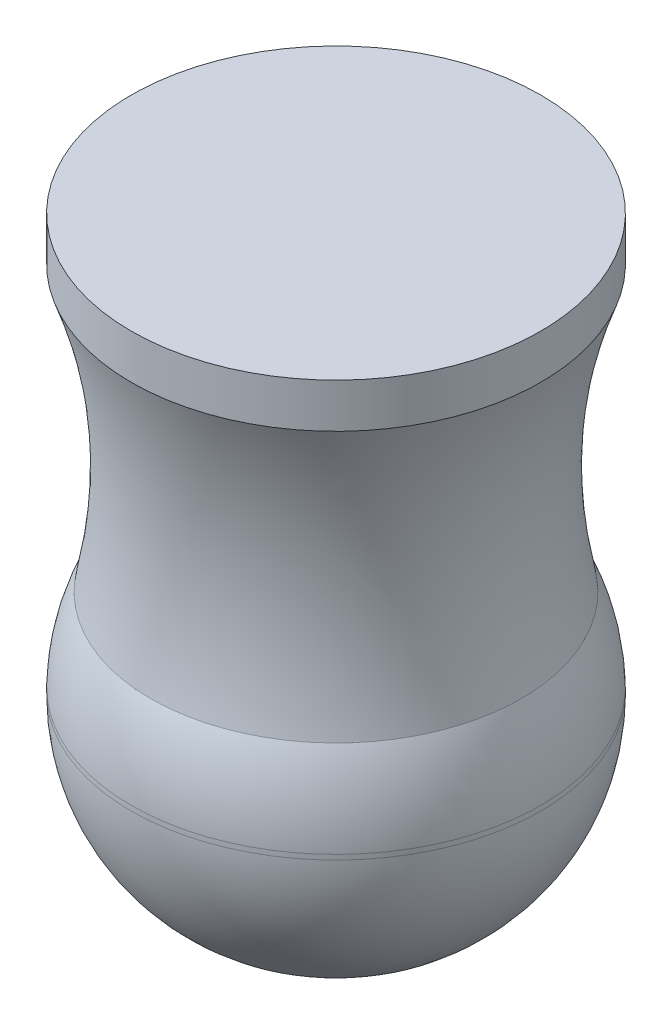
from build123d import *

# Parameters (mm, degrees)
SKETCH_2_R      = 3.003688101
EXTRUDE_1_DEPTH = 9
FILLET_1_R      = 2.9


with BuildPart() as part:
    # 草图2 → 凸台-拉伸1 (new body)
    with BuildSketch(Plane(origin=(0, -1.4, 0), x_dir=(1, 0, 0), z_dir=(0, 1, 0))):
        with Locations(Location((0, 0, 0), (0, 0, 270))):
            Circle(SKETCH_2_R)
    extrude(amount=EXTRUDE_1_DEPTH)

    # 圆角1
    fillet_1_edges = [part.edges().sort_by_distance(p)[0] for p in [
        (0, -1.4, -3.003688101),
    ]]
    fillet(fillet_1_edges, radius=FILLET_1_R)

    # 草图3 → 切除-旋转2 (revolve, cut)
    with BuildSketch(Plane(origin=(0, 0, 0), x_dir=(0, 0, -1), z_dir=(1, 0, 0)), mode=Mode.PRIVATE) as cut_revolve_2_sk:
        with BuildLine():
            Line((3.004365599, 1.508670114), (3.004365599, 6.951153744))
            add(Edge.make_bspline(
                [(3.004365599, 6.951153744), (2.268764656, 4.943240983), (2.718706105, 2.786306846)],
                knots=[0, 0, 0, 1, 1, 1], degree=2))
            ThreePointArc((2.718706105, 2.786306846), (2.932079854, 2.16326101), (3.004365599, 1.508670114))
        make_face()
    revolve(cut_revolve_2_sk.sketch.rotate(Axis((0, 7.6, 0), (0, -1, 0)), 180), axis=Axis((0, 7.6, 0), (0, -1, 0)), mode=Mode.SUBTRACT)


solid = part.part
